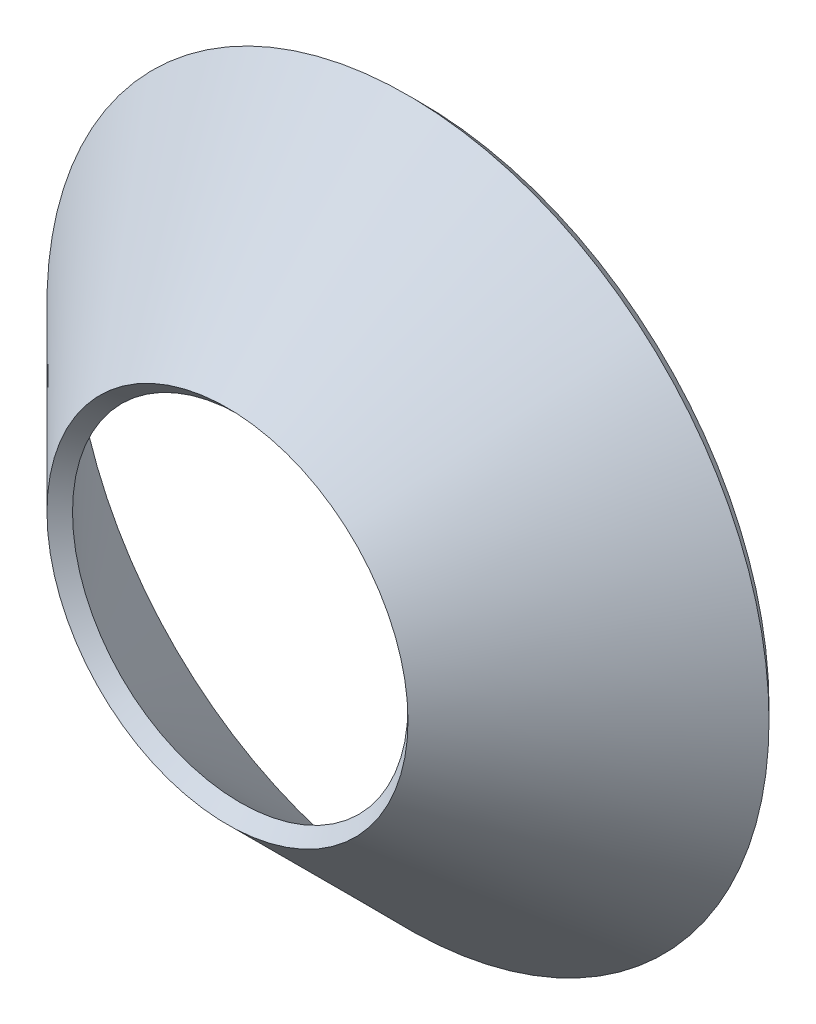
from build123d import *


with BuildPart() as part:
    # Sketch1 → Revolve-Thin1 (revolve)
    with BuildSketch(Plane.YZ, mode=Mode.PRIVATE) as revolve_thin1_sk:
        Polygon((25.4, 25.4), (50.8, 0), (49.003948776, -1.796051224), (23.603948776, 23.603948776), align=None)
    revolve(revolve_thin1_sk.sketch.rotate(Axis((0, 0, 26.67), (0, 0, -1)), 90), axis=Axis((0, 0, 26.67), (0, 0, -1)))


solid = part.part
